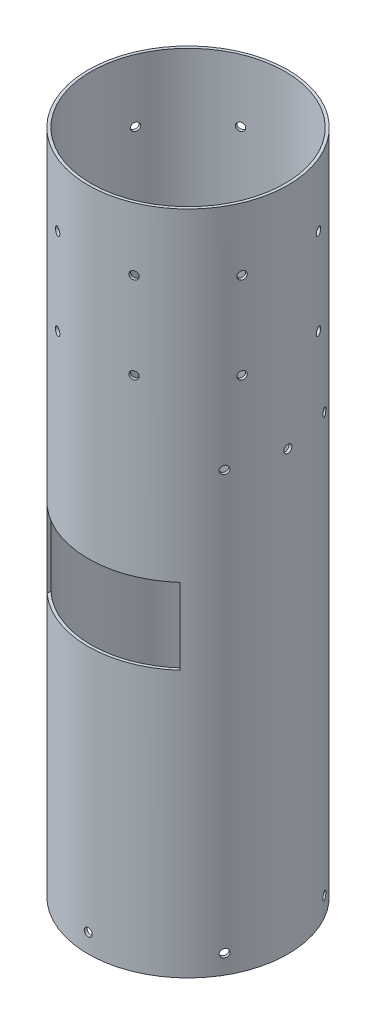
from build123d import *

# Parameters (mm, degrees)
SKETCH_1_W               = 1.5
SKETCH_1_H               = 350
SKETCH_2_R               = 2.1
CUT_EXTRUDE_2_DEPTH      = 88
PATTERN_CIRCULAR_2_COUNT = 6
SKETCH_8_R               = 2.1
CUT_EXTRUDE_3_DEPTH      = 32
PATTERN_CIRCULAR_3_COUNT = 8
SKETCH_9_R               = 2.1
CUT_EXTRUDE_4_DEPTH      = 171
PATTERN_CIRCULAR_4_COUNT = 2
PATTERN_CIRCULAR_4_ANGLE = 30
F_4_THE_OTHER_WAY_COUNT  = 2
F_4_THE_OTHER_WAY_ANGLE  = 30
SKETCH_10_W              = 70
SKETCH_10_H              = 40
CUT_EXTRUDE_5_DEPTH      = 358.788345386


with BuildPart() as part:
    # Эскиз1 → Повернуть1 (revolve)
    with BuildSketch(Plane.XY, mode=Mode.PRIVATE) as revolve_1_sk:
        with Locations((51.75, 175)):
            Rectangle(SKETCH_1_W, SKETCH_1_H)
    revolve(revolve_1_sk.sketch.rotate(Axis((0, 0, 0), (0, 1, 0)), 90), axis=Axis((0, 0, 0), (0, 1, 0)))

    # Эскиз2 → Вырез-Вытянуть2 (cut)
    with BuildSketch(Plane.XY):
        with Locations(Location((0, 10, 0), (0, 0, 90))):
            Circle(SKETCH_2_R)
    cut_extrude_2 = extrude(amount=-CUT_EXTRUDE_2_DEPTH, mode=Mode.SUBTRACT)

    # Круговой массив2: Вырез-Вытянуть2 ×6 about axis
    pattern_circular_2_axis = Axis((0, 0, 0), (0, -1, 0))
    for i in range(1, PATTERN_CIRCULAR_2_COUNT):
        add(cut_extrude_2.rotate(pattern_circular_2_axis, i * 360 / PATTERN_CIRCULAR_2_COUNT), mode=Mode.SUBTRACT)

    # Эскиз8 → Вырез-Вытянуть3 (cut)
    with BuildSketch(Plane(origin=(18.03122292, 0, 43.53122292), x_dir=(0.9238795325112864, 0, -0.3826834323650906), z_dir=(0.3826834323650906, 0, 0.9238795325112864))):
        with Locations(Location((0, 317, 0), (0, 0, 180))):
            Circle(SKETCH_8_R)
        with Locations(Location((0, 271.5, 0), (0, 0, 180))):
            Circle(SKETCH_8_R)
    cut_extrude_3 = extrude(amount=CUT_EXTRUDE_3_DEPTH, mode=Mode.SUBTRACT)

    # Круговой массив3: Вырез-Вытянуть3 ×8 about axis
    pattern_circular_3_axis = Axis((0, 0, 0), (0, -1, 0))
    for i in range(1, PATTERN_CIRCULAR_3_COUNT):
        add(cut_extrude_3.rotate(pattern_circular_3_axis, i * 360 / PATTERN_CIRCULAR_3_COUNT), mode=Mode.SUBTRACT)

    # Эскиз9 → Вырез-Вытянуть4 (cut)
    with BuildSketch(Plane(origin=(0, 0, 0), x_dir=(0, 0, -1), z_dir=(1, 0, 0))):
        with Locations(Location((0, 230, 0), (0, 0, 180))):
            Circle(SKETCH_9_R)
    cut_extrude_4 = extrude(amount=CUT_EXTRUDE_4_DEPTH, mode=Mode.SUBTRACT)

    # Круговой массив4: Вырез-Вытянуть4 ×2 about axis
    pattern_circular_4_axis = Axis((0, 0, 0), (0, -1, 0))
    for i in range(1, PATTERN_CIRCULAR_4_COUNT):
        add(cut_extrude_4.rotate(pattern_circular_4_axis, i * PATTERN_CIRCULAR_4_ANGLE / (PATTERN_CIRCULAR_4_COUNT - 1)), mode=Mode.SUBTRACT)

    # 4 the other way: Вырез-Вытянуть4 ×2 about axis
    f_4_the_other_way_axis = Axis((0, 0, 0), (0, 1, 0))
    for i in range(1, F_4_THE_OTHER_WAY_COUNT):
        add(cut_extrude_4.rotate(f_4_the_other_way_axis, i * F_4_THE_OTHER_WAY_ANGLE / (F_4_THE_OTHER_WAY_COUNT - 1)), mode=Mode.SUBTRACT)

    # Эскиз10 → Вырез-Вытянуть5 (cut, through all)
    with BuildSketch(Plane.XY):
        with Locations((0, 160)):
            Rectangle(SKETCH_10_W, SKETCH_10_H)
    extrude(amount=CUT_EXTRUDE_5_DEPTH, mode=Mode.SUBTRACT)


solid = part.part
